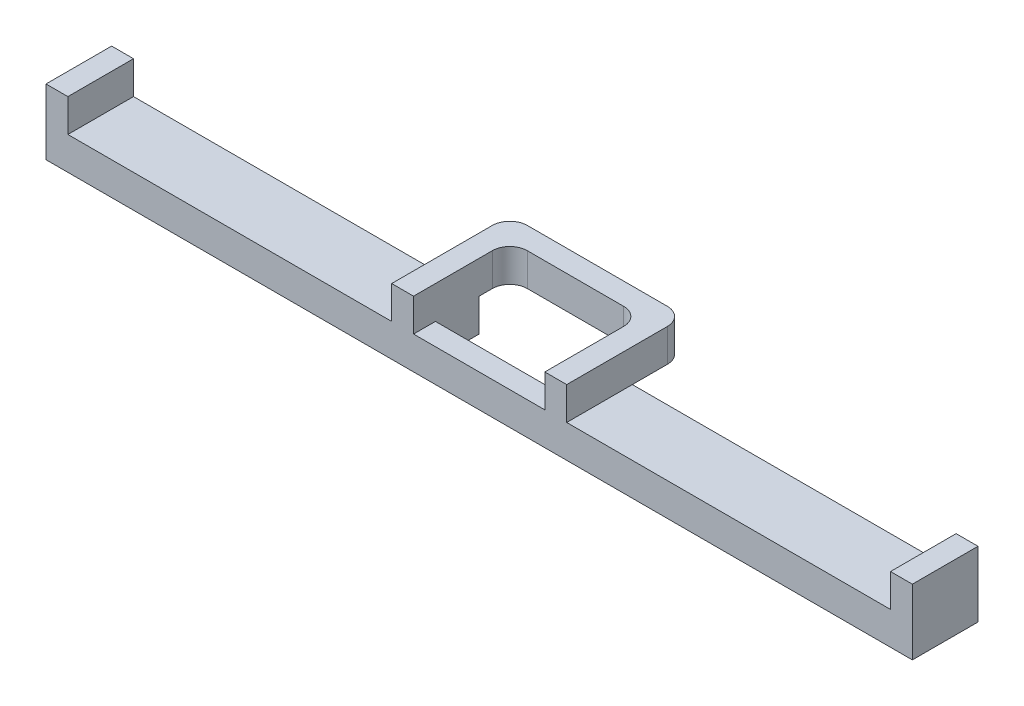
from build123d import *

# Parameters (mm, degrees)
EXTRUDE_1_DEPTH          = 15
EXTRUDE_2_DEPTH          = 15
CUT_EXTRUDE_1_DEPTH      = 101.410407827
CUT_EXTRUDE_1_DEPTH_BACK = 101.410407827
SKETCH_3_W               = 30
SKETCH_3_H               = 10
EXTRUDE_3_DEPTH          = 7.5


with BuildPart() as part:
    # 草图1 → 凸台-拉伸1 (new body)
    with BuildSketch(Plane.XY):
        Polygon((-94, 7.5), (-99, 7.5), (-99, -7.5), (99, -7.5), (99, 7.5), (94, 7.5), (94, 0), (-94, 0), align=None)
    extrude(amount=EXTRUDE_1_DEPTH)

    # 草图2 → 凸台-拉伸2 (add)
    with BuildSketch(Plane.XY.offset(15)):
        Polygon((20, -7.5), (-20, -7.5), (-20, 7.5), (-15, 7.5), (-15, 0), (15, 0), (15, 7.5), (20, 7.5), align=None)
    extrude(amount=-EXTRUDE_2_DEPTH)

    # 草图3 → 切除-拉伸1 (cut, two sides: drawn at the far end of the back side and taken through both)
    with BuildSketch(Plane(origin=(0, 0, 0), x_dir=(1, 0, 0), z_dir=(0, 1, 0)).offset(-CUT_EXTRUDE_1_DEPTH_BACK)):
        with Locations((0, -5)):
            Rectangle(SKETCH_3_W, SKETCH_3_H)
    extrude(amount=CUT_EXTRUDE_1_DEPTH + CUT_EXTRUDE_1_DEPTH_BACK, mode=Mode.SUBTRACT)

    # 草图4 → 凸台-拉伸3 (add)
    with BuildSketch(Plane(origin=(0, 0, 0), x_dir=(1, 0, 0), z_dir=(0, 1, 0))):
        with BuildLine():
            Line((-15, -11.176683095), (-15, 3))
            ThreePointArc((-15, 3), (-13.828427125, 5.828427125), (-11, 7))
            Line((-11, 7), (11, 7))
            ThreePointArc((11, 7), (13.828427125, 5.828427125), (15, 3))
            Line((15, 3), (15, 0))
            Line((15, 0), (20, 0))
            Line((20, 0), (20, 8))
            ThreePointArc((20, 8), (18.828427125, 10.828427125), (16, 12))
            Line((16, 12), (-16, 12))
            ThreePointArc((-16, 12), (-18.828427125, 10.828427125), (-20, 8))
            Line((-20, 8), (-20, -11.176683095))
            Line((-20, -11.176683095), (-15, -11.176683095))
        make_face()
    extrude(amount=EXTRUDE_3_DEPTH)


solid = part.part
